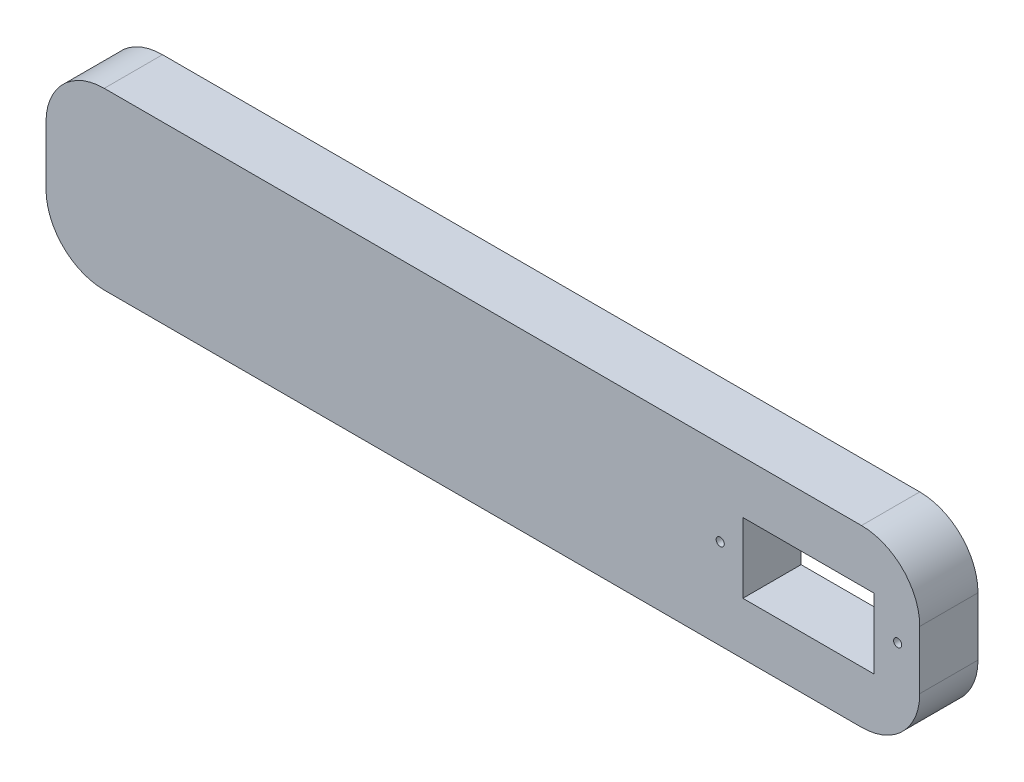
from build123d import *

# Parameters (mm, degrees)
BOSS_EXTRUDE1_DEPTH                                 = 10
SKETCH2_W                                           = 22.52
SKETCH2_H                                           = 12.02
CUT_EXTRUDE1_DEPTH                                  = 154.297097168
CBORE_FOR_00_BINDING_HEAD_MACHINE_SCREW_D           = 1.397
CBORE_FOR_00_BINDING_HEAD_MACHINE_SCREW_CBORE_D     = 3.175
CBORE_FOR_00_BINDING_HEAD_MACHINE_SCREW_CBORE_DEPTH = 0.7112


with BuildPart() as part:
    # Sketch1 → Boss-Extrude1 (new body)
    with BuildSketch(Plane.XY):
        with BuildLine():
            Line((10, 0), (140, 0))
            ThreePointArc((140, 0), (147.071067812, 2.928932188), (150, 10))
            Line((150, 10), (150, 20))
            ThreePointArc((150, 20), (147.071067812, 27.071067812), (140, 30))
            Line((140, 30), (10, 30))
            ThreePointArc((10, 30), (2.928932188, 27.071067812), (0, 20))
            Line((0, 20), (0, 10))
            ThreePointArc((0, 10), (2.928932188, 2.928932188), (10, 0))
        make_face()
    extrude(amount=BOSS_EXTRUDE1_DEPTH)

    # Sketch2 → Cut-Extrude1 (cut, through all)
    with BuildSketch(Plane(origin=(0, 0, 0), x_dir=(-1, 0, 0), z_dir=(0, 0, -1))):
        with Locations((-130.892658662, 15.006569468)):
            Rectangle(SKETCH2_W, SKETCH2_H)
    extrude(amount=-CUT_EXTRUDE1_DEPTH, mode=Mode.SUBTRACT)

    # CBORE for #00 Binding Head Machine Screw3 (through all)
    with Locations(Plane(origin=(0, 0, 0), x_dir=(-1, 0, 0), z_dir=(0, 0, -1))):
        with Locations((-146.209359197, 15.668360935), (-115.743972015, 15.453815955)):
            CounterBoreHole(CBORE_FOR_00_BINDING_HEAD_MACHINE_SCREW_D / 2, CBORE_FOR_00_BINDING_HEAD_MACHINE_SCREW_CBORE_D / 2, CBORE_FOR_00_BINDING_HEAD_MACHINE_SCREW_CBORE_DEPTH)


solid = part.part
